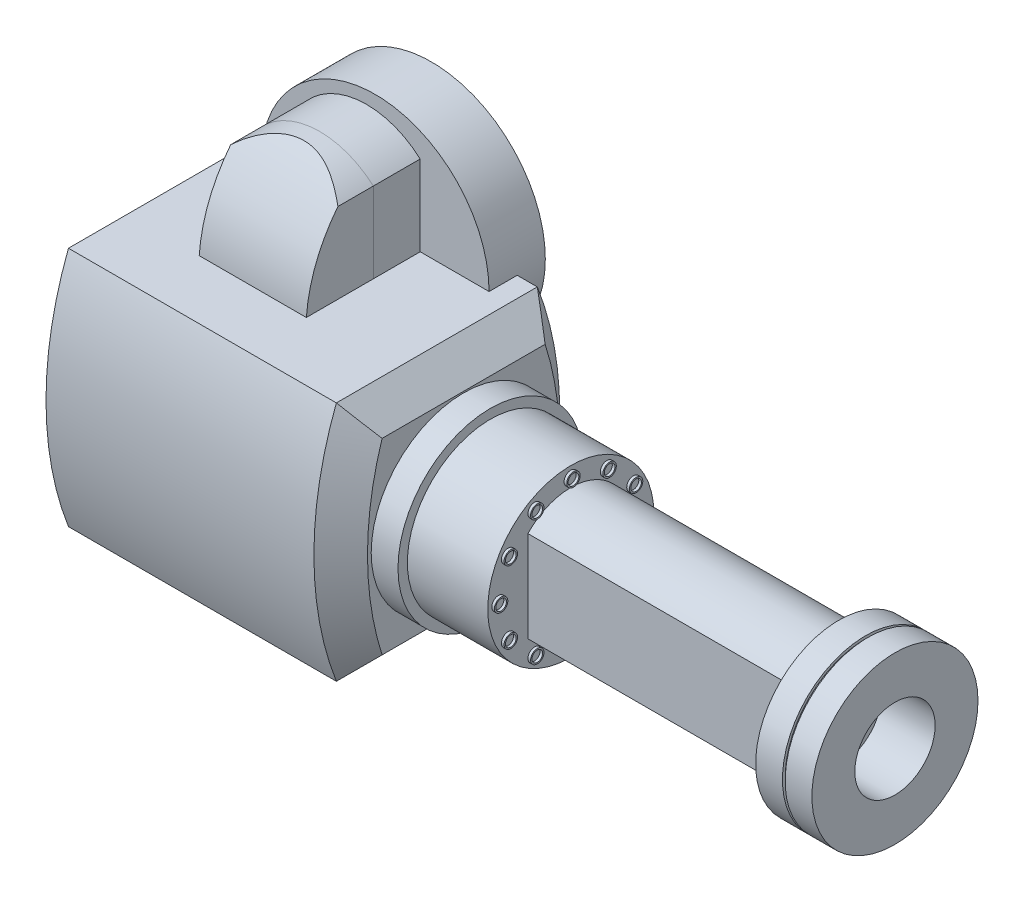
from build123d import *

# Parameters (mm, degrees)
BOSS_EXTRUDE1_DEPTH  = 100
BOSS_EXTRUDE2_DEPTH  = 10
BOSS_EXTRUDE2_DRAFT  = 45
SKETCH5_R            = 34.5
BOSS_EXTRUDE3_DEPTH  = 10
SKETCH6_R            = 31
BOSS_EXTRUDE4_DEPTH  = 30
SKETCH7_R            = 2.5
SKETCH7_R_2          = 2
BOSS_EXTRUDE5_DEPTH  = 1
CIRPATTERN1_COUNT    = 12
BOSS_EXTRUDE6_DEPTH  = 100
SKETCH10_R           = 31
BOSS_EXTRUDE7_DEPTH  = 10
SKETCH11_R           = 30
BOSS_EXTRUDE8_DEPTH  = 1
SKETCH12_R           = 31
BOSS_EXTRUDE9_DEPTH  = 10
SKETCH13_R           = 42.5
BOSS_EXTRUDE10_DEPTH = 10.5
BOSS_EXTRUDE11_DEPTH = 17.5
BOSS_EXTRUDE15_DEPTH = 40
CUT_EXTRUDE2_START   = -40
CUT_EXTRUDE2_DEPTH   = 40
SKETCH25_R           = 15
CUT_EXTRUDE3_DEPTH   = 20
SKETCH26_R           = 12.5
CUT_EXTRUDE4_DEPTH   = 20


with BuildPart() as part:
    # Sketch1 → Boss-Extrude1 (new body)
    with BuildSketch(Plane(origin=(0, 0, 0), x_dir=(0, 0, -1), z_dir=(1, 0, 0))):
        with BuildLine():
            Line((-37.5, 45), (37.5, 45))
            ThreePointArc((37.5, 45), (45.880962103, 0), (37.5, -45))
            Line((37.5, -45), (-37.5, -45))
            ThreePointArc((-37.5, -45), (-45.880962103, 0), (-37.5, 45))
        make_face()
    extrude(amount=BOSS_EXTRUDE1_DEPTH)



with BuildPart() as body_2:
    # Sketch4 → Boss-Extrude2 (with draft: the straight prism first)
    with BuildSketch(Plane(origin=(100, 0, 0), x_dir=(0, 0, -1), z_dir=(1, 0, 0))):
        with BuildLine():
            Line((37.5, 45), (-37.5, 45))
            ThreePointArc((-37.5, 45), (-45.880962103, 0), (-37.5, -45))
            Line((-37.5, -45), (37.5, -45))
            ThreePointArc((37.5, -45), (45.880962103, 0), (37.5, 45))
        make_face()
    extrude(amount=BOSS_EXTRUDE2_DEPTH)
    # Boss-Extrude2: the draft: its side faces are tilted about the plane it starts from
    boss_extrude2_sides = [body_2.faces().sort_by_distance(p)[0] for p in [
        (105, 45, 0),
        (105, 0, 45.880962103),
        (105, -45, 0),
        (105, 0, -45.880962103),
    ]]
    draft(boss_extrude2_sides, Plane(origin=(100, 0, 0), x_dir=(0, 0, -1), z_dir=(1, 0, 0)), BOSS_EXTRUDE2_DRAFT)


with BuildPart() as body_3:
    # Sketch5 → Boss-Extrude3 (new body)
    with BuildSketch(Plane(origin=(110, 0, 0), x_dir=(0, 0, -1), z_dir=(1, 0, 0))):
        Circle(SKETCH5_R)
    extrude(amount=BOSS_EXTRUDE3_DEPTH)

    # Sketch6 → Boss-Extrude4 (add)
    with BuildSketch(Plane(origin=(120, 0, 0), x_dir=(0, 0, -1), z_dir=(1, 0, 0))):
        Circle(SKETCH6_R)
    extrude(amount=BOSS_EXTRUDE4_DEPTH)

    # Sketch7 → Boss-Extrude5 (add)
    with BuildSketch(Plane(origin=(150, 0, 0), x_dir=(0, 0, -1), z_dir=(1, 0, 0))):
        with Locations((27, 0)):
            Circle(SKETCH7_R)
        with Locations((27, 0)):
            Circle(SKETCH7_R_2, mode=Mode.SUBTRACT)
    boss_extrude5 = extrude(amount=BOSS_EXTRUDE5_DEPTH)

    # CirPattern1: Boss-Extrude5 ×12 about axis
    cirpattern1_axis = Axis((0, 0, 0), (1, 0, 0))
    for i in range(1, CIRPATTERN1_COUNT):
        add(boss_extrude5.rotate(cirpattern1_axis, i * 360 / CIRPATTERN1_COUNT))

    # Sketch9 → Boss-Extrude6 (add)
    with BuildSketch(Plane(origin=(150, 0, 0), x_dir=(0, 0, -1), z_dir=(1, 0, 0))):
        with BuildLine():
            Line((16, -17), (16, 17))
            ThreePointArc((16, 17), (0, 23.900331129), (-16, 17))
            Line((-16, 17), (-16, -17))
            ThreePointArc((-16, -17), (0, -23.900331129), (16, -17))
        make_face()
    extrude(amount=BOSS_EXTRUDE6_DEPTH)

    # Sketch10 → Boss-Extrude7 (add)
    with BuildSketch(Plane(origin=(250, 0, 0), x_dir=(0, 0, -1), z_dir=(1, 0, 0))):
        Circle(SKETCH10_R)
    extrude(amount=BOSS_EXTRUDE7_DEPTH)

    # Sketch11 → Boss-Extrude8 (add)
    with BuildSketch(Plane(origin=(260, 0, 0), x_dir=(0, 0, -1), z_dir=(1, 0, 0))):
        Circle(SKETCH11_R)
    extrude(amount=BOSS_EXTRUDE8_DEPTH)

    # Sketch12 → Boss-Extrude9 (add)
    with BuildSketch(Plane(origin=(261, 0, 0), x_dir=(0, 0, -1), z_dir=(1, 0, 0))):
        Circle(SKETCH12_R)
    extrude(amount=BOSS_EXTRUDE9_DEPTH)

    # Sketch25 → Cut-Extrude3 (cut)
    with BuildSketch(Plane(origin=(271, 0, 0), x_dir=(0, 0, -1), z_dir=(1, 0, 0))):
        Circle(SKETCH25_R)
    extrude(amount=-CUT_EXTRUDE3_DEPTH, mode=Mode.SUBTRACT)


with BuildPart() as body_4:
    # Sketch13 → Boss-Extrude10 (new, symmetric)
    with BuildSketch(Plane.XY.offset(-37.5)):
        with Locations((50, 45)):
            Circle(SKETCH13_R)
    extrude(amount=BOSS_EXTRUDE10_DEPTH, both=True)


with BuildPart() as part_1:
    add(part.part)

    add(body_4.part)  # Boss-Extrude11 merges body 4
    # Sketch16 → Boss-Extrude11 (add, symmetric)
    with BuildSketch(Plane.XY.offset(-27)):
        with BuildLine():
            Line((26.796556005, 45), (66.796556005, 45))
            Line((66.796556005, 45), (66.796556005, 75))
            ThreePointArc((66.796556005, 75), (46.796556005, 82.639320225), (26.796556005, 75))
            Line((26.796556005, 75), (26.796556005, 45))
        make_face()
    extrude(amount=BOSS_EXTRUDE11_DEPTH, both=True)

    # Sketch26 → Cut-Extrude4 (cut)
    with BuildSketch(Plane(origin=(0, 0, -48), x_dir=(-1, 0, 0), z_dir=(0, 0, -1))):
        with Locations((-50, 45)):
            Circle(SKETCH26_R)
    extrude(amount=-CUT_EXTRUDE4_DEPTH, mode=Mode.SUBTRACT)


with BuildPart() as body_4_2:
    # Sketch17 → Boss-Extrude15 (new body)
    with BuildSketch(Plane(origin=(66.796556005, 0, 0), x_dir=(0, 0, -1), z_dir=(1, 0, 0))):
        with BuildLine():
            Line((9.5, 45), (9.5, 87))
            ThreePointArc((9.5, 87), (-7.921855105, 68.929675658), (-15.5, 45))
            Line((-15.5, 45), (9.5, 45))
        make_face()
    extrude(amount=-BOSS_EXTRUDE15_DEPTH)

    # Sketch24 → Cut-Extrude2 (cut)
    with BuildSketch(Plane(origin=(0, 0, -9.5), x_dir=(-1, 0, 0), z_dir=(0, 0, -1)).offset(CUT_EXTRUDE2_START)):
        with BuildLine():
            Line((-26.796556005, 75), (-26.796556005, 95.375947624))
            Line((-26.796556005, 95.375947624), (-66.796556005, 96.108223455))
            Line((-66.796556005, 96.108223455), (-66.796556005, 75))
            ThreePointArc((-66.796556005, 75), (-46.796556005, 82.639320225), (-26.796556005, 75))
        make_face()
    extrude(amount=CUT_EXTRUDE2_DEPTH, mode=Mode.SUBTRACT)


solid = Compound([body_2.part, body_3.part, part_1.part, body_4_2.part])
